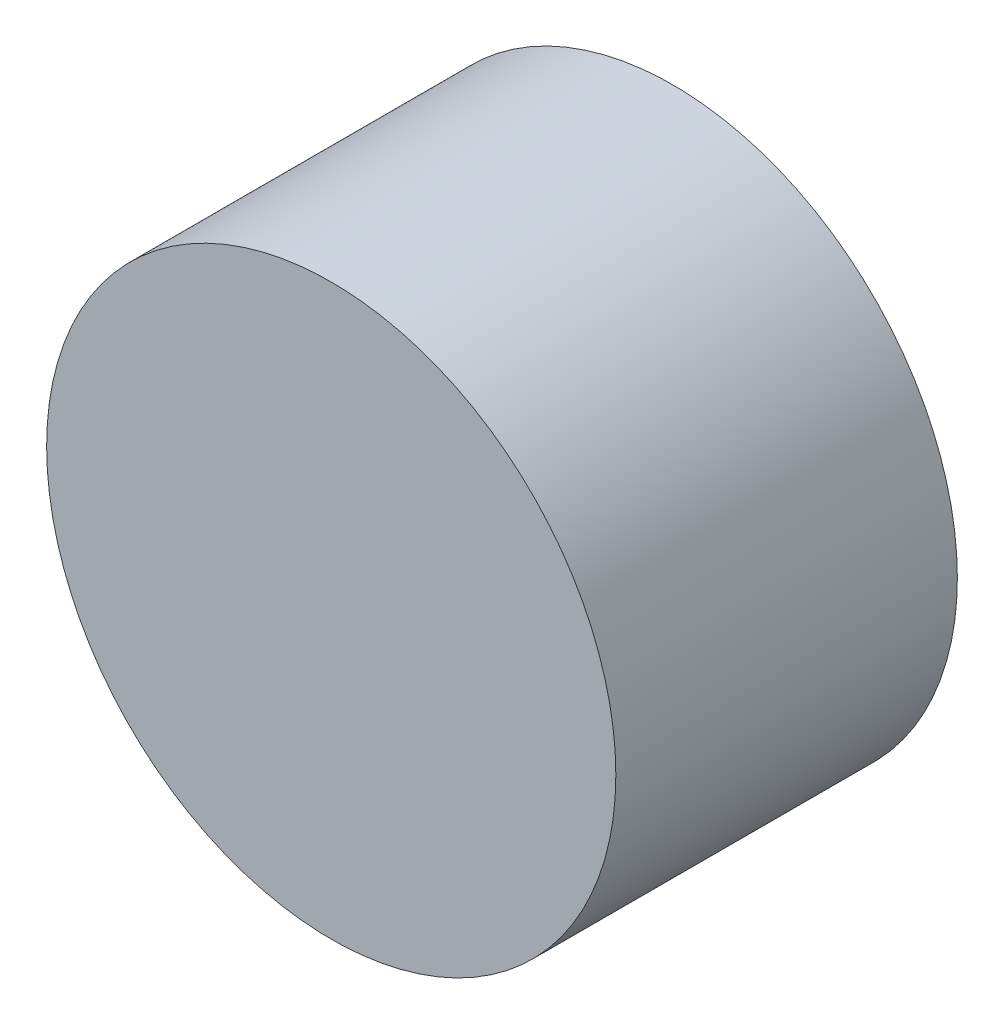
from build123d import *

# Parameters (mm, degrees)
SKETCH_1_R      = 2.5
EXTRUDE_1_DEPTH = 3


with BuildPart() as part:
    # ｽｹｯﾁ1 → ﾎﾞｽ - 押し出し1 (new body)
    with BuildSketch(Plane.XY):
        Circle(SKETCH_1_R)
    extrude(amount=EXTRUDE_1_DEPTH)


solid = part.part
